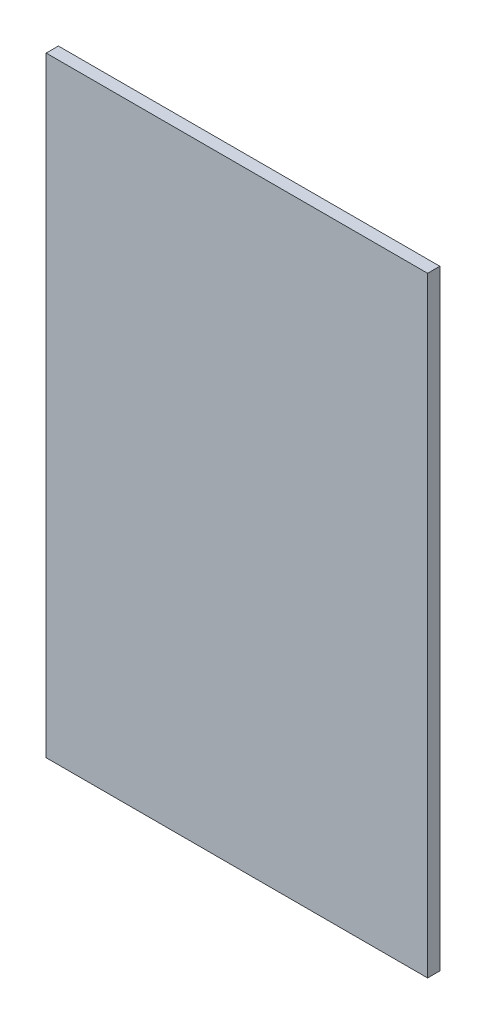
from build123d import *

# Parameters (mm, degrees)
SKETCH1_W           = 25
SKETCH1_H           = 40
BOSS_EXTRUDE1_DEPTH = 0.8


with BuildPart() as part:
    # Sketch1 → Boss-Extrude1 (new body)
    with BuildSketch(Plane.XY):
        with Locations((-78.267011565, -22.480659235)):
            Rectangle(SKETCH1_W, SKETCH1_H)
    extrude(amount=BOSS_EXTRUDE1_DEPTH)


solid = part.part
